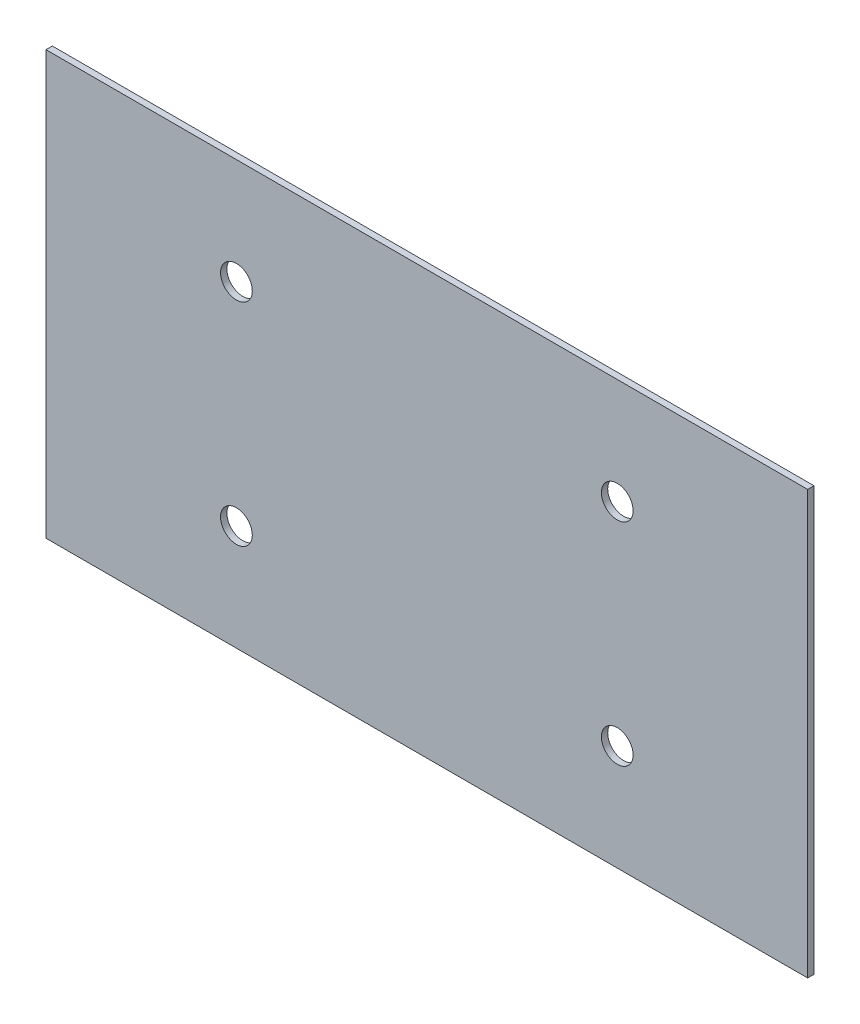
from build123d import *

# Parameters (mm, degrees)
CROQUIS1_W              = 360
CROQUIS1_H              = 200
SALIENTE_EXTRUIR1_DEPTH = 3
CROQUIS2_R              = 7.5
CORTAR_EXTRUIR1_DEPTH   = 10


with BuildPart() as part:
    # Croquis1 → Saliente-Extruir1 (new body)
    with BuildSketch(Plane.XY):
        Rectangle(CROQUIS1_W, CROQUIS1_H)
    extrude(amount=SALIENTE_EXTRUIR1_DEPTH)

    # Croquis2 → Cortar-Extruir1 (cut)
    with BuildSketch(Plane(origin=(0, 0, 0), x_dir=(-1, 0, 0), z_dir=(0, 0, -1))):
        with Locations((-90, 50)):
            Circle(CROQUIS2_R)
        with Locations((90, 50)):
            Circle(CROQUIS2_R)
        with Locations((90, -50)):
            Circle(CROQUIS2_R)
        with Locations((-90, -50)):
            Circle(CROQUIS2_R)
    extrude(amount=-CORTAR_EXTRUIR1_DEPTH, mode=Mode.SUBTRACT)


solid = part.part
